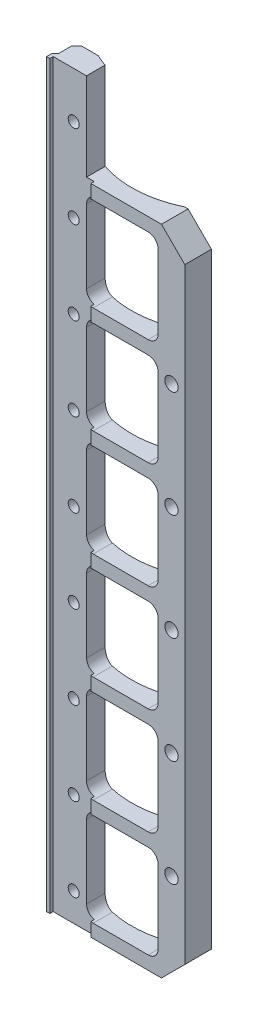
from build123d import *

# Parameters (mm, degrees)
BOSS_EXTRU_1_DEPTH         = 222.35
ENL_V_MAT_EXTRU_1_DEPTH    = 227.331112256
R_P_TITION_LIN_AIRE1_COUNT = 8
R_P_TITION_LIN_AIRE1_PITCH = 32
ESQUISSE3_R                = 1.65
ENL_V_MAT_EXTRU_2_DEPTH    = 227.297972637
ENL_V_MAT_EXTRU_3_DEPTH    = 3
R_P_TITION_LIN_AIRE2_COUNT = 9
R_P_TITION_LIN_AIRE2_PITCH = 25
ESQUISSE7_R                = 2
ENL_V_MAT_EXTRU_4_DEPTH    = 227.331112358
R_P_TITION_LIN_AIRE3_COUNT = 5
R_P_TITION_LIN_AIRE3_PITCH = 32
ESQUISSE12_W               = 30.500000119
ESQUISSE12_H               = 26.35
ENL_V_MAT_EXTRU_6_DEPTH    = 227.331112358
CHANFREIN1_SIZE            = 7


with BuildPart() as part:
    # Esquisse1 → Boss.-Extru.1 (new body)
    with BuildSketch(Plane(origin=(0, 0, 0), x_dir=(1, 0, 0), z_dir=(0, 1, 0))):
        with BuildLine():
            Line((0, -8.00000038), (0, 0))
            Line((0, 0), (-8.00000038, 0))
            ThreePointArc((-8.00000038, 0), (-21.000001114, -2.960555112), (-34.000001848, 0))
            Line((-34.000001848, 0), (-39.000000805, 0))
            Line((-39.000000805, 0), (-40.500000119, -1.500000246))
            Line((-40.500000119, -1.500000246), (-40.500000119, -5.500000436))
            Line((-40.500000119, -5.500000436), (-41.49999842, -6.500000367))
            Line((-41.49999842, -6.500000367), (-41.49999842, -8.00000038))
            Line((-41.49999842, -8.00000038), (-40.500000119, -8.00000038))
            Line((-40.500000119, -8.00000038), (-40.500000119, -7.000000332))
            Line((-40.500000119, -7.000000332), (-28.200000119, -7.000000332))
            Line((-28.200000119, -7.000000332), (-28.200000119, -8.00000038))
            Line((-28.200000119, -8.00000038), (0, -8.00000038))
        make_face()
    extrude(amount=BOSS_EXTRU_1_DEPTH)

    # Esquisse2 → Enlèv. mat.-Extru.1 (cut, through all)
    with BuildSketch(Plane(origin=(0, 0, 0), x_dir=(-1, 0, 0), z_dir=(0, 0, -1))):
        with BuildLine():
            Line((11, 4), (27.500000119, 4))
            ThreePointArc((27.500000119, 4), (29.621320463, 4.878679656), (30.500000119, 7))
            Line((30.500000119, 7), (30.500000119, 29))
            ThreePointArc((30.500000119, 29), (29.621320463, 31.121320344), (27.500000119, 32))
            Line((27.500000119, 32), (11, 32))
            ThreePointArc((11, 32), (8.878679656, 31.121320344), (8, 29))
            Line((8, 29), (8, 7))
            ThreePointArc((8, 7), (8.878679656, 4.878679656), (11, 4))
        make_face()
    enl_v_mat_extru_1 = extrude(amount=-ENL_V_MAT_EXTRU_1_DEPTH, mode=Mode.SUBTRACT)

    # Répétition linéaire1: Enlèv. mat.-Extru.1 ×8
    with Locations(*[(0, i * R_P_TITION_LIN_AIRE1_PITCH, 0) for i in range(1, R_P_TITION_LIN_AIRE1_COUNT)]):
        add(enl_v_mat_extru_1, mode=Mode.SUBTRACT)

    # Esquisse3 → Enlèv. mat.-Extru.2 (cut, through all)
    with BuildSketch(Plane.XY.offset(7.000000332)):
        with Locations((-34.350000119, 8.5)):
            Circle(ESQUISSE3_R)
    enl_v_mat_extru_2 = extrude(amount=-ENL_V_MAT_EXTRU_2_DEPTH, mode=Mode.SUBTRACT)

    # Esquisse5 → Enlèv. mat.-Extru.3 (cut)
    with BuildSketch(Plane(origin=(0, 0, 0), x_dir=(-1, 0, 0), z_dir=(0, 0, -1))):
        Polygon((37.100000119, 6.91228676), (37.100000119, 10.08771324), (34.350000119, 11.675426481), (31.600000119, 10.08771324), (31.600000119, 6.91228676), (34.350000119, 5.324573519), align=None)
    enl_v_mat_extru_3 = extrude(amount=-ENL_V_MAT_EXTRU_3_DEPTH, mode=Mode.SUBTRACT)

    # Répétition linéaire2: Enlèv. mat.-Extru.2, Enlèv. mat.-Extru.3 ×9
    with Locations(*[(0, i * R_P_TITION_LIN_AIRE2_PITCH, 0) for i in range(1, R_P_TITION_LIN_AIRE2_COUNT)]):
        add(enl_v_mat_extru_2, mode=Mode.SUBTRACT)
        add(enl_v_mat_extru_3, mode=Mode.SUBTRACT)

    # Esquisse7 → Enlèv. mat.-Extru.4 (cut, through all)
    with BuildSketch(Plane(origin=(0, 0, 0), x_dir=(-1, 0, 0), z_dir=(0, 0, -1))):
        with Locations((4.00000019, 28)):
            Circle(ESQUISSE7_R)
    enl_v_mat_extru_4 = extrude(amount=-ENL_V_MAT_EXTRU_4_DEPTH, mode=Mode.SUBTRACT)

    # Répétition linéaire3: Enlèv. mat.-Extru.4 ×5
    with Locations(*[(0, i * R_P_TITION_LIN_AIRE3_PITCH, 0) for i in range(1, R_P_TITION_LIN_AIRE3_COUNT)]):
        add(enl_v_mat_extru_4, mode=Mode.SUBTRACT)

    # Esquisse12 → Enlèv. mat.-Extru.6 (cut, through all)
    with BuildSketch(Plane.XY.offset(8.00000038)):
        with Locations((-15.25000006, 209.175)):
            Rectangle(ESQUISSE12_W, ESQUISSE12_H)
    extrude(amount=-ENL_V_MAT_EXTRU_6_DEPTH, mode=Mode.SUBTRACT)

    # Chanfrein1
    chanfrein1_edges = [part.edges().sort_by_distance(p)[0] for p in [
        (0, 0, 4.00000019),
        (0, 196, 4.00000019),
    ]]
    chamfer(chanfrein1_edges, length=CHANFREIN1_SIZE)


solid = part.part
